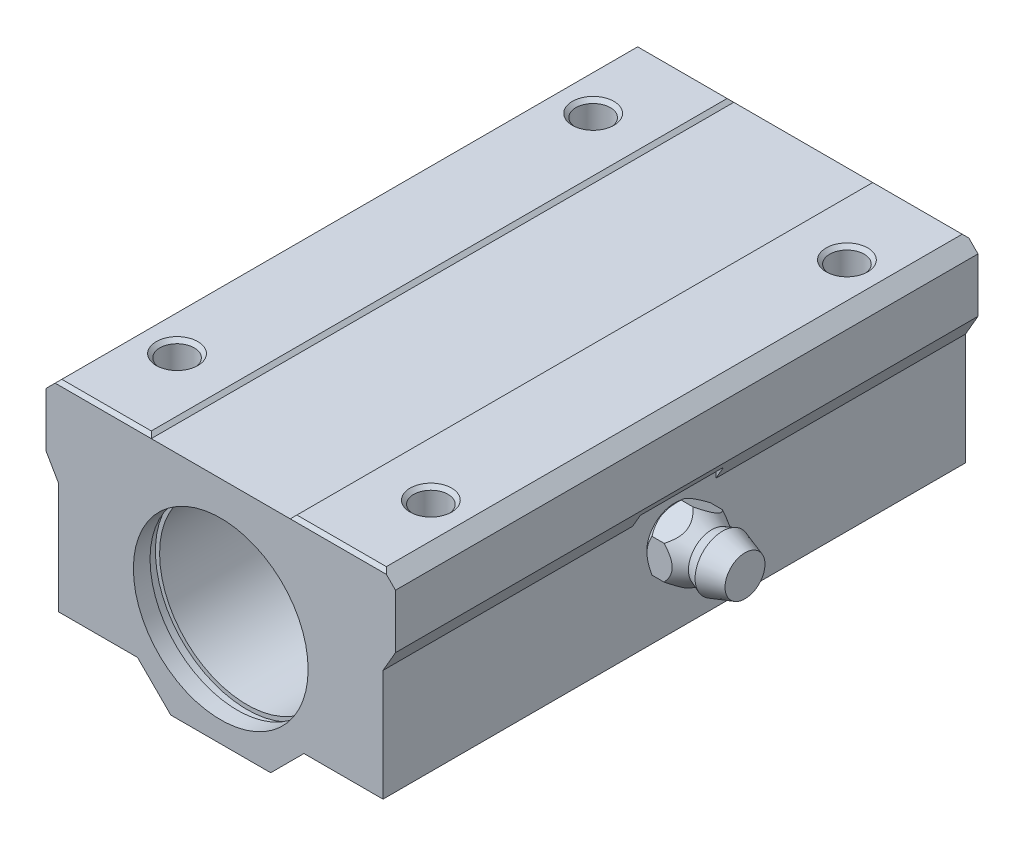
from build123d import *

# Parameters (mm, degrees)
BOSS_EXTRUDE1_DEPTH     = 81
CUT_EXTRUDE1_DEPTH      = 42
CUT_EXTRUDE1_DEPTH_BACK = 42
SKETCH2_W               = 2931
SKETCH2_H               = 2169
SKETCH9_W               = 10
SKETCH9_H               = 10
CUT_EXTRUDE2_DEPTH      = 10
CUT_EXTRUDE3_START      = -28
SKETCH11_W              = 238.622036278
SKETCH11_H              = 213.304880218
SKETCH11_W_2            = 101.706666714
SKETCH11_H_2            = 70
CUT_EXTRUDE3_DEPTH      = 28
CHAMFER1_SIZE           = 0.4


with BuildPart() as part:
    # Sketch1 → Boss-Extrude1 (new body)
    with BuildSketch(Plane.XY):
        Polygon((-21, 12.5), (-21, 6), (-19.5, 3.401923789), (-19.5, -10), (-10, -10), (-6, -14), (6, -14), (10, -10), (19.5, -10), (19.5, 3.401923789), (21, 6), (21, 12.5), (19.5, 14), (8.75, 14), (8.35, 13.6), (-8.35, 13.6), (-8.75, 14), (-19.5, 14), align=None)
    extrude(amount=BOSS_EXTRUDE1_DEPTH)

    # Sketch2 → Cut-Extrude1 (cut, two sides: drawn at the far end of the back side and taken through both)
    with BuildSketch(Plane(origin=(0, 0, 0), x_dir=(0, 0, -1), z_dir=(1, 0, 0)).offset(-CUT_EXTRUDE1_DEPTH_BACK)):
        with Locations((-31.5, -9.5)):
            Rectangle(SKETCH2_W, SKETCH2_H)
        Polygon((-81, -14), (0, -14), (0, 13.6), (-0.4, 14), (-80.6, 14), (-81, 13.6), align=None, mode=Mode.SUBTRACT)
    extrude(amount=CUT_EXTRUDE1_DEPTH + CUT_EXTRUDE1_DEPTH_BACK, mode=Mode.SUBTRACT)

    # Sketch3 → Cut-Revolve1 (revolve, cut)
    with BuildSketch(Plane.XY.offset(15.5), mode=Mode.PRIVATE) as cut_revolve1_sk:
        Polygon((-15.25, 14), (-12.75, 14), (-13.183, 13.567), (-13.183, 2), (-13.1, 2), (-13.1, -10), (-15.25, -10), align=None)
    revolve(cut_revolve1_sk.sketch.rotate(Axis((-15.25, -10, 15.5), (0, 1, 0)), 270), axis=Axis((-15.25, -10, 15.5), (0, 1, 0)), mode=Mode.SUBTRACT)

    # Sketch4 → Cut-Revolve2 (revolve, cut)
    with BuildSketch(Plane.XY.offset(15.5), mode=Mode.PRIVATE) as cut_revolve2_sk:
        Polygon((15.25, 14), (17.75, 14), (17.317, 13.567), (17.317, 2), (17.4, 2), (17.4, -10), (15.25, -10), align=None)
    revolve(cut_revolve2_sk.sketch.rotate(Axis((15.25, -10, 15.5), (0, 1, 0)), 270), axis=Axis((15.25, -10, 15.5), (0, 1, 0)), mode=Mode.SUBTRACT)

    # Sketch5 → Cut-Revolve3 (revolve, cut)
    with BuildSketch(Plane.XY.offset(65.5), mode=Mode.PRIVATE) as cut_revolve3_sk:
        Polygon((-15.25, 14), (-12.75, 14), (-13.183, 13.567), (-13.183, 2), (-13.1, 2), (-13.1, -10), (-15.25, -10), align=None)
    revolve(cut_revolve3_sk.sketch.rotate(Axis((-15.25, -10, 65.5), (0, 1, 0)), 270), axis=Axis((-15.25, -10, 65.5), (0, 1, 0)), mode=Mode.SUBTRACT)

    # Sketch6 → Cut-Revolve4 (revolve, cut)
    with BuildSketch(Plane.XY.offset(65.5), mode=Mode.PRIVATE) as cut_revolve4_sk:
        Polygon((15.25, 14), (17.75, 14), (17.317, 13.567), (17.317, 2), (17.4, 2), (17.4, -10), (15.25, -10), align=None)
    revolve(cut_revolve4_sk.sketch.rotate(Axis((15.25, -10, 65.5), (0, 1, 0)), 270), axis=Axis((15.25, -10, 65.5), (0, 1, 0)), mode=Mode.SUBTRACT)

    # Sketch7 → Cut-Revolve5 (revolve, cut)
    with BuildSketch(Plane(origin=(0, 0, 0), x_dir=(0, 0, -1), z_dir=(1, 0, 0)), mode=Mode.PRIVATE) as cut_revolve5_sk:
        Polygon((-81, -1), (-81, 9.5), (-73.5, 9.5), (-73.5, 10), (-72.35, 10), (-72.35, 9.5), (-8.65, 9.5), (-8.65, 10), (-7.5, 10), (-7.5, 9.5), (0, 9.5), (0, -1), align=None)
    revolve(cut_revolve5_sk.sketch.rotate(Axis((0, -1, 0), (0, 0, 1)), 270), axis=Axis((0, -1, 0), (0, 0, 1)), mode=Mode.SUBTRACT)

    # Sketch8 → Revolve1 (revolve)
    with BuildSketch(Plane.XY.offset(40.5), mode=Mode.PRIVATE) as revolve1_sk:
        Polygon((19.5, 0), (19.5, 3.3), (20.5, 4.2), (21.5, 4.2), (24, 2.8), (25.3, 3.3), (28, 2.4), (28, 0), align=None)
    revolve(revolve1_sk.sketch.rotate(Axis((28, 0, 40.5), (-1, 0, 0)), 270), axis=Axis((28, 0, 40.5), (-1, 0, 0)))

    # Sketch9 → Cut-Extrude2 (cut)
    with BuildSketch(Plane(origin=(19.5, 0, 0), x_dir=(0, 0, -1), z_dir=(1, 0, 0))):
        with Locations((-40.5, 0)):
            Rectangle(SKETCH9_W, SKETCH9_H)
        Polygon((-44, 2.020725942), (-44, -2.020725942), (-40.5, -4.041451884), (-37, -2.020725942), (-37, 2.020725942), (-40.5, 4.041451884), align=None, mode=Mode.SUBTRACT)
    extrude(amount=CUT_EXTRUDE2_DEPTH, mode=Mode.SUBTRACT)

    # Sketch10 → Cut-Revolve6 (revolve, cut)
    with BuildSketch(Plane.XY.offset(40.5), mode=Mode.PRIVATE) as cut_revolve6_sk:
        Polygon((19.5, 4.2), (19.5, 3.3), (20.5, 4.2), align=None)
    revolve(cut_revolve6_sk.sketch.rotate(Axis((28, 0, 40.5), (-1, 0, 0)), 59.999999594), axis=Axis((28, 0, 40.5), (-1, 0, 0)), mode=Mode.SUBTRACT)

    # Sketch11 → Cut-Extrude3 (cut)
    with BuildSketch(Plane(origin=(0, 14, 0), x_dir=(1, 0, 0), z_dir=(0, 1, 0)).offset(CUT_EXTRUDE3_START)):
        with Locations((12.049646303, -40.5)):
            Rectangle(SKETCH11_W, SKETCH11_H)
        with Locations((12.049646303, -40.5)):
            Rectangle(SKETCH11_W_2, SKETCH11_H_2, mode=Mode.SUBTRACT)
    extrude(amount=CUT_EXTRUDE3_DEPTH, mode=Mode.SUBTRACT)

    # Chamfer1
    chamfer1_edges = [part.edges().sort_by_distance(p)[0] for p in [
        (-14.125, 14, 5.5),
        (14.125, 14, 5.5),
        (14.125, 14, 75.5),
        (-14.125, 14, 75.5),
    ]]
    chamfer(chamfer1_edges, length=CHAMFER1_SIZE)


solid = part.part
